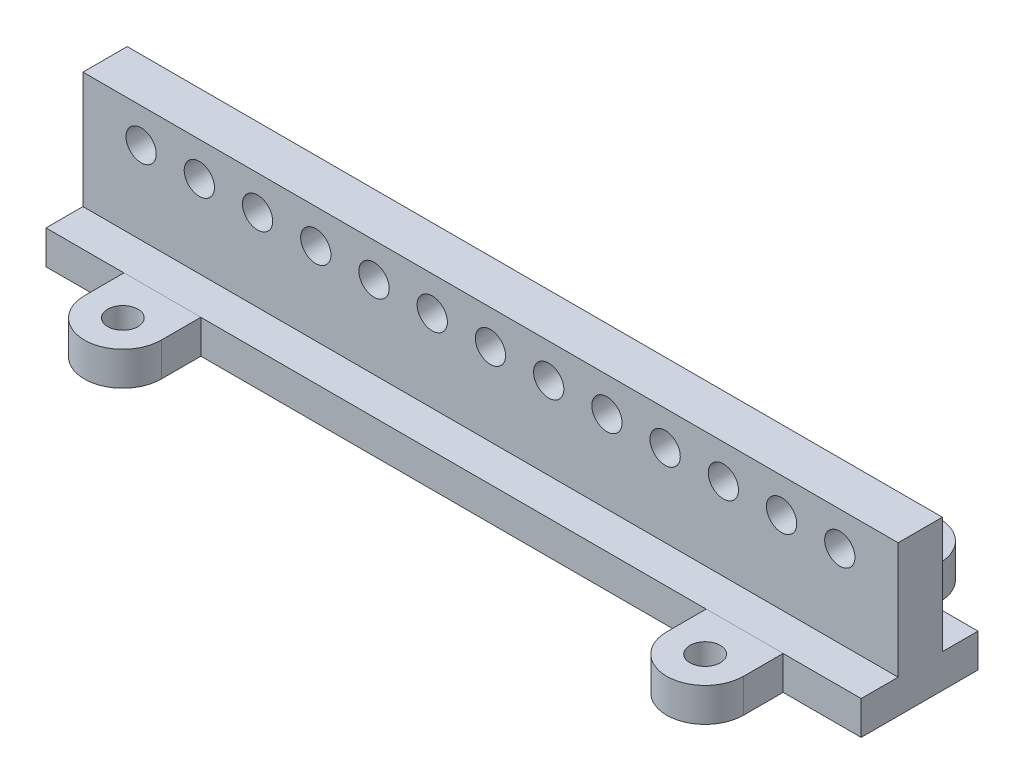
from build123d import *

# Parameters (mm, degrees)
SKETCH1_W           = 88.9
SKETCH1_H           = 25.4
BOSS_EXTRUDE1_DEPTH = 4.826
SKETCH3_W           = 88.9
SKETCH3_H           = 12.7
CUT_EXTRUDE2_DEPTH  = 93.583261317
BOSS_EXTRUDE2_DEPTH = 88.9
SKETCH7_W           = 88.9
SKETCH7_H           = 2.676927262
CUT_EXTRUDE3_DEPTH  = 94.331081232
SKETCH9_W           = 4.826
SKETCH9_H           = 6.35
BOSS_EXTRUDE3_DEPTH = 88.9
SKETCH11_R          = 1.651
CUT_EXTRUDE4_DEPTH  = 95.800625252
SKETCH13_R          = 1.651
BOSS_EXTRUDE4_DEPTH = 3.683


with BuildPart() as part:
    # Sketch1 → Boss-Extrude1 (new body)
    with BuildSketch(Plane.XY):
        with Locations((-44.45, 12.7)):
            Rectangle(SKETCH1_W, SKETCH1_H)
    extrude(amount=BOSS_EXTRUDE1_DEPTH)

    # Sketch3 → Cut-Extrude2 (cut, through all)
    with BuildSketch(Plane.XY.offset(4.826)):
        with Locations((-44.45, 6.35)):
            Rectangle(SKETCH3_W, SKETCH3_H)
    extrude(amount=-CUT_EXTRUDE2_DEPTH, mode=Mode.SUBTRACT)

    # Sketch6 → Boss-Extrude2 (add)
    with BuildSketch(Plane.ZY.offset(88.9)):
        Polygon((2.413, 12.7), (8.855255209, 12.7), (8.855255209, 19.05), (-3.885259846, 19.05), (-3.885259846, 12.7), align=None)
    extrude(amount=-BOSS_EXTRUDE2_DEPTH)

    # Sketch7 → Cut-Extrude3 (cut, through all)
    with BuildSketch(Plane.XY.offset(8.855255209)):
        with Locations((-44.45, 14.038463631)):
            Rectangle(SKETCH7_W, SKETCH7_H)
    extrude(amount=-CUT_EXTRUDE3_DEPTH, mode=Mode.SUBTRACT)

    # Sketch9 → Boss-Extrude3 (add)
    with BuildSketch(Plane.ZY.offset(88.9)):
        with Locations((2.413, 28.575)):
            Rectangle(SKETCH9_W, SKETCH9_H)
    extrude(amount=-BOSS_EXTRUDE3_DEPTH)

    # Sketch11 → Cut-Extrude4 (cut, through all)
    with BuildSketch(Plane.XY.offset(4.826)):
        with Locations((-82.557217843, 28.012581488)):
            Circle(SKETCH11_R)
        with Locations((-76.207217843, 28.012581488)):
            Circle(SKETCH11_R)
        with Locations((-69.857217843, 28.012581488)):
            Circle(SKETCH11_R)
        with Locations((-63.507217843, 28.012581488)):
            Circle(SKETCH11_R)
        with Locations((-57.157217843, 28.012581488)):
            Circle(SKETCH11_R)
        with Locations((-50.807217843, 28.012581488)):
            Circle(SKETCH11_R)
        with Locations((-44.457217843, 28.012581488)):
            Circle(SKETCH11_R)
        with Locations((-38.107217843, 28.012581488)):
            Circle(SKETCH11_R)
        with Locations((-31.757217843, 28.012581488)):
            Circle(SKETCH11_R)
        with Locations((-25.407217843, 28.012581488)):
            Circle(SKETCH11_R)
        with Locations((-19.057217843, 28.012581488)):
            Circle(SKETCH11_R)
        with Locations((-12.707217843, 28.012581488)):
            Circle(SKETCH11_R)
        with Locations((-6.357217843, 28.012581488)):
            Circle(SKETCH11_R)
    extrude(amount=-CUT_EXTRUDE4_DEPTH, mode=Mode.SUBTRACT)

    # Sketch13 → Boss-Extrude4 (add)
    # profile 1 of 2: a face of its own
    with BuildSketch(Plane(origin=(0, 15.376927262, 0), x_dir=(-1, 0, 0), z_dir=(0, -1, 0))):
        with BuildLine():
            Line((80.391, -8.855255209), (80.391, -13.173255209))
            ThreePointArc((80.391, -13.173255209), (76.2, -17.364255209), (72.009, -13.173255209))
            Line((72.009, -13.173255209), (72.009, -8.855255209))
            Line((72.009, -8.855255209), (80.391, -8.855255209))
        make_face()
        with Locations(Location((76.2, -13.173255209, 0), (0, 0, 90))):
            Circle(SKETCH13_R, mode=Mode.SUBTRACT)
    # profile 2 of 2: a face of its own
    with BuildSketch(Plane(origin=(0, 15.376927262, 0), x_dir=(-1, 0, 0), z_dir=(0, -1, 0))):
        with BuildLine():
            Line((72.009, 3.885259846), (72.009, 8.203259846))
            ThreePointArc((72.009, 8.203259846), (76.2, 12.394259846), (80.391, 8.203259846))
            Line((80.391, 8.203259846), (80.391, 3.885259846))
            Line((80.391, 3.885259846), (72.009, 3.885259846))
        make_face()
        with Locations(Location((76.2, 8.203259846, 0), (0, 0, 90))):
            Circle(SKETCH13_R, mode=Mode.SUBTRACT)
    boss_extrude4 = extrude(amount=-BOSS_EXTRUDE4_DEPTH)

    # Mirror2: Boss-Extrude4 across plane
    add(boss_extrude4.mirror(Plane(origin=(-44.45, 0, 0), x_dir=(0, 0, 1), z_dir=(1, 0, 0))))


solid = part.part
